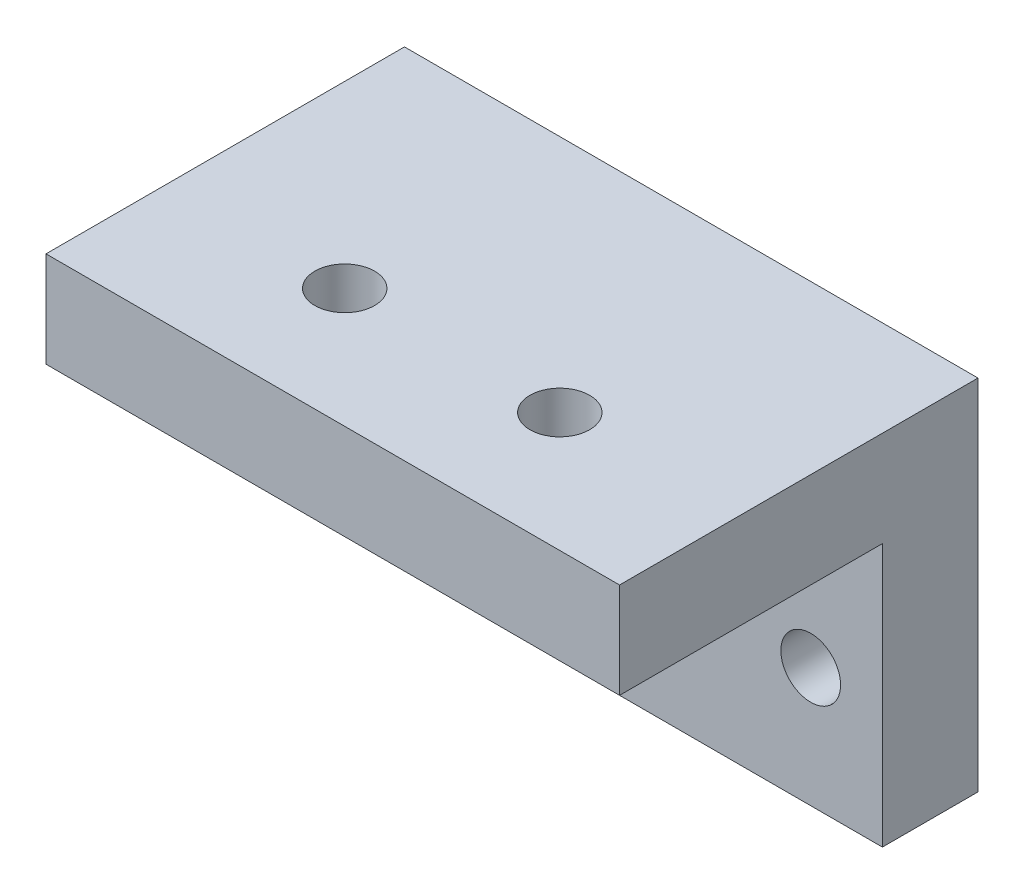
from build123d import *

# Parameters (mm, degrees)
SKETCH_1_W          = 24
SKETCH_1_H          = 15
EXTRUDE_1_DEPTH     = 4
SKETCH_2_W          = 24
SKETCH_2_H          = 4
EXTRUDE_2_DEPTH     = 11
SKETCH_3_R          = 1.25
CUT_EXTRUDE_1_DEPTH = 18.923448329
SKETCH_4_R          = 1.25
CUT_EXTRUDE_2_DEPTH = 23.135943621


with BuildPart() as part:
    # 草图1 → 凸台-拉伸1 (new body)
    with BuildSketch(Plane.XY):
        Rectangle(SKETCH_1_W, SKETCH_1_H)
    extrude(amount=EXTRUDE_1_DEPTH)

    # 草图2 → 凸台-拉伸2 (add)
    with BuildSketch(Plane.XY.offset(4)):
        with Locations((0, 5.5)):
            Rectangle(SKETCH_2_W, SKETCH_2_H)
    extrude(amount=EXTRUDE_2_DEPTH)

    # 草图3 → 切除-拉伸1 (cut, through all)
    with BuildSketch(Plane.XY.offset(4)):
        with Locations((-9, -2.5)):
            Circle(SKETCH_3_R)
        with Locations((9, -2.5)):
            Circle(SKETCH_3_R)
    extrude(amount=-CUT_EXTRUDE_1_DEPTH, mode=Mode.SUBTRACT)

    # 草图4 → 切除-拉伸2 (cut, through all)
    with BuildSketch(Plane.XZ.offset(-3.5)):
        with Locations(Location((-4.5, 10, 0), (0, 0, 270))):
            Circle(SKETCH_4_R)
        with Locations(Location((4.5, 10, 0), (0, 0, 270))):
            Circle(SKETCH_4_R)
    extrude(amount=-CUT_EXTRUDE_2_DEPTH, mode=Mode.SUBTRACT)


solid = part.part
